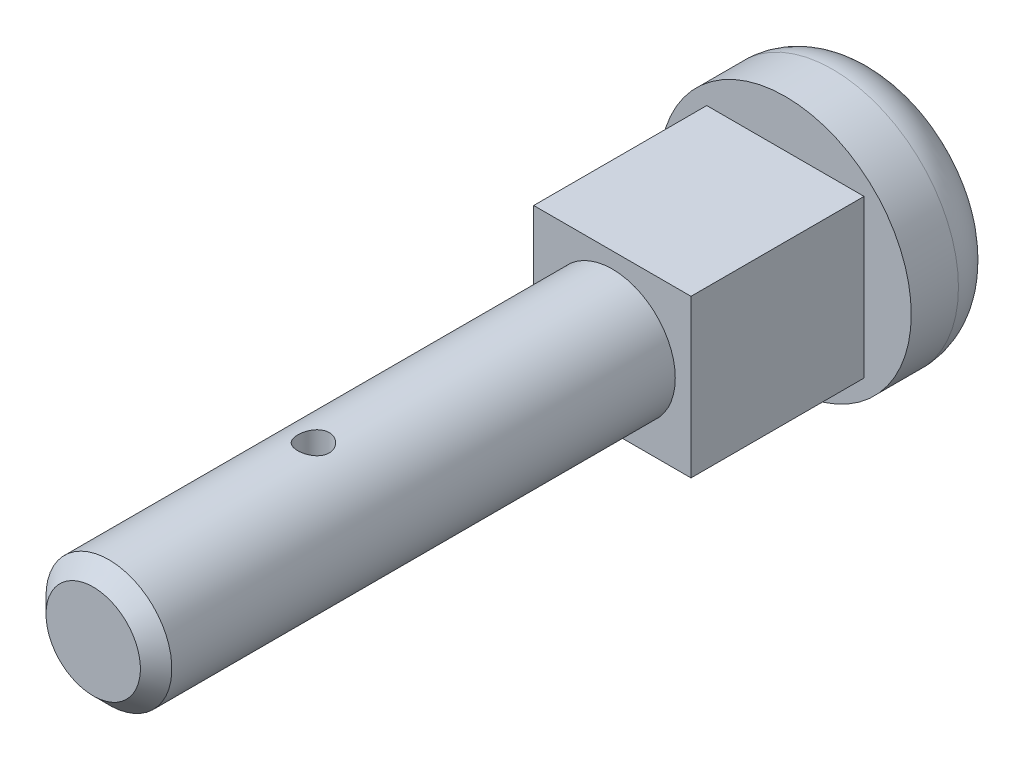
from build123d import *

# Parameters (mm, degrees)
SKETCH1_R                = 8
BOSS_EXTRUDE1_DEPTH      = 6
SKETCH2_W                = 10
SKETCH2_H                = 10
BOSS_EXTRUDE2_DEPTH      = 11
SKETCH4_R                = 4
BOSS_EXTRUDE3_DEPTH      = 44
F_2_0_2_DIAMETER_HOLE1_D = 2
FILLET1_R                = 3
CHAMFER1_SIZE            = 1


with BuildPart() as part:
    # Sketch1 → Boss-Extrude1 (new body)
    with BuildSketch(Plane.XY):
        Circle(SKETCH1_R)
    extrude(amount=-BOSS_EXTRUDE1_DEPTH)

    # Sketch2 → Boss-Extrude2 (add)
    with BuildSketch(Plane.XY):
        Rectangle(SKETCH2_W, SKETCH2_H)
    extrude(amount=BOSS_EXTRUDE2_DEPTH)

    # Sketch4 → Boss-Extrude3 (add)
    with BuildSketch(Plane.XY):
        Circle(SKETCH4_R)
    extrude(amount=BOSS_EXTRUDE3_DEPTH)

    # Ø2.0 (2) Diameter Hole1 (through all)
    with Locations(Plane(origin=(0, 4, 30), x_dir=(1, 0, 0), z_dir=(0, 1, 0))):
        with Locations((0, 0)):
            Hole(F_2_0_2_DIAMETER_HOLE1_D / 2)

    # Fillet1
    fillet1_edges = [part.edges().sort_by_distance(p)[0] for p in [
        (-8, 0, -6),
    ]]
    fillet(fillet1_edges, radius=FILLET1_R)

    # Chamfer1
    chamfer1_edges = [part.edges().sort_by_distance(p)[0] for p in [
        (-4, 0, 44),
    ]]
    chamfer(chamfer1_edges, length=CHAMFER1_SIZE)


solid = part.part
